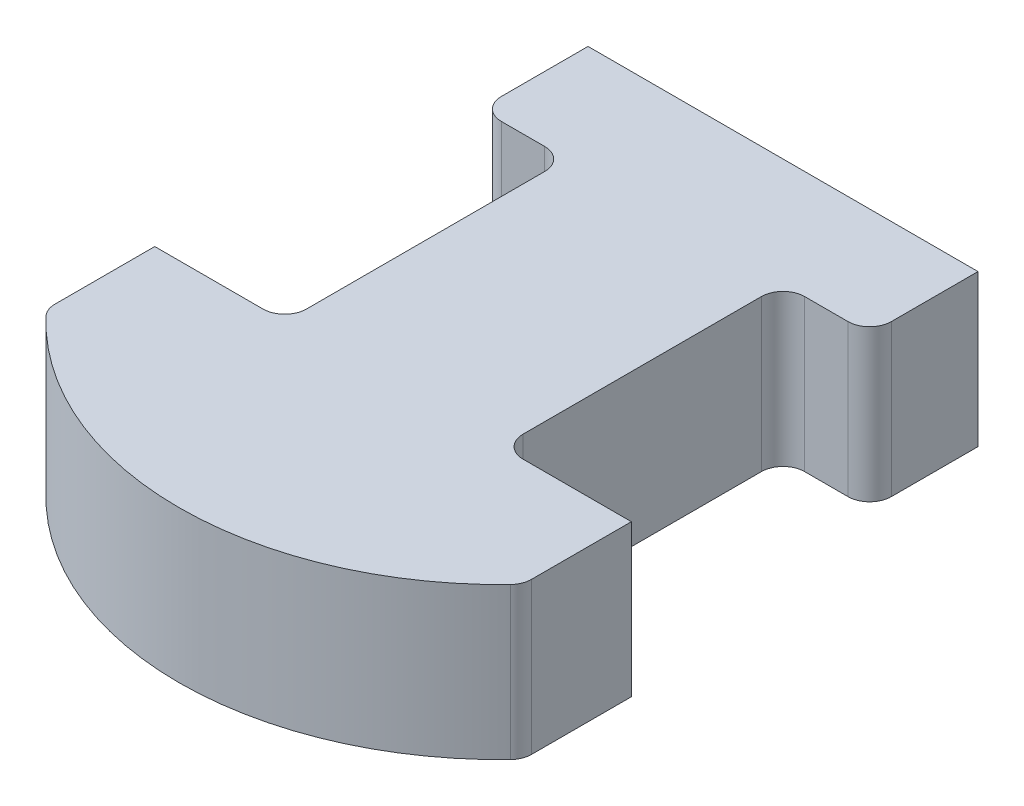
from build123d import *

# Parameters (mm, degrees)
BOSS_EXTRUDE1_DEPTH = 70
FILLET3_R           = 10
BOSS_EXTRUDE2_DEPTH = 10
FILLET4_R           = 10


with BuildPart() as part:
    # Sketch1 → Boss-Extrude1 (new body)
    with BuildSketch(Plane(origin=(0, 0, 0), x_dir=(1, 0, 0), z_dir=(0, 1, 0))):
        with BuildLine():
            Line((-90, 17.965988739), (90, 17.965988739))
            Line((90, 17.965988739), (90, -32.034011261))
            Line((90, -32.034011261), (50, -32.034011261))
            Line((50, -32.034011261), (50, -162.034011261))
            Line((50, -162.034011261), (110, -162.034011261))
            Line((110, -162.034011261), (110, -212.034011261))
            ThreePointArc((110, -212.034011261), (0, -260.808853853), (-110, -212.034011261))
            Line((-110, -212.034011261), (-110, -162.034011261))
            Line((-110, -162.034011261), (-50, -162.034011261))
            Line((-50, -162.034011261), (-50, -32.034011261))
            Line((-50, -32.034011261), (-90, -32.034011261))
            Line((-90, -32.034011261), (-90, 17.965988739))
        make_face()
        with BuildLine():
            Line((-80, 14.965988739), (80, 14.965988739))
            Line((80, 14.965988739), (80, -29.034011261))
            Line((80, -29.034011261), (45, -29.034011261))
            Line((45, -29.034011261), (45, -167.034011261))
            Line((45, -167.034011261), (95, -167.034011261))
            Line((95, -167.034011261), (95, -211.241666668))
            Line((95, -211.241666668), (58.77564579, -211.241666668))
            ThreePointArc((58.77564579, -211.241666668), (-10.047427033, -232.545270894), (-78.870499857, -211.241666668))
            Line((-78.870499857, -211.241666668), (-95, -211.241666668))
            Line((-95, -211.241666668), (-95, -167.034011261))
            Line((-95, -167.034011261), (-45, -167.034011261))
            Line((-45, -167.034011261), (-45, -29.034011261))
            Line((-45, -29.034011261), (-80, -29.034011261))
            Line((-80, -29.034011261), (-80, 14.965988739))
        make_face(mode=Mode.SUBTRACT)
    extrude(amount=BOSS_EXTRUDE1_DEPTH)

    # Fillet3
    fillet3_edges = [part.edges().sort_by_distance(p)[0] for p in [
        (-90, 35, 32.034011261),
    ]]
    fillet(fillet3_edges, radius=FILLET3_R)

    # Sketch9 → Boss-Extrude2 (add)
    with BuildSketch(Plane(origin=(0, 70, 0), x_dir=(1, 0, 0), z_dir=(0, 1, 0))):
        with BuildLine():
            Line((-90, 17.965988739), (-90, -22.034011261))
            ThreePointArc((-90, -22.034011261), (-87.071067812, -29.105079073), (-80, -32.034011261))
            Line((-80, -32.034011261), (-50, -32.034011261))
            Line((-50, -32.034011261), (-50, -162.034011261))
            Line((-50, -162.034011261), (-110, -162.034011261))
            Line((-110, -162.034011261), (-110, -212.034011261))
            ThreePointArc((-110, -212.034011261), (0, -260.808853853), (110, -212.034011261))
            Line((110, -212.034011261), (110, -162.034011261))
            Line((110, -162.034011261), (50, -162.034011261))
            Line((50, -162.034011261), (50, -32.034011261))
            Line((50, -32.034011261), (90, -32.034011261))
            Line((90, -32.034011261), (90, 17.965988739))
            Line((90, 17.965988739), (-90, 17.965988739))
        make_face()
    extrude(amount=-BOSS_EXTRUDE2_DEPTH)

    # Fillet4
    fillet4_edges = [part.edges().sort_by_distance(p)[0] for p in [
        (-45, 30, 167.034011261),
        (-45, 30, 29.034011261),
        (-80, 30, 29.034011261),
        (90, 35, 32.034011261),
        (50, 35, 32.034011261),
        (50, 35, 162.034011261),
        (110, 35, 212.034011261),
        (-110, 35, 212.034011261),
        (-50, 35, 162.034011261),
        (-50, 35, 32.034011261),
        (80, 30, 29.034011261),
        (45, 30, 29.034011261),
        (45, 30, 167.034011261),
    ]]
    fillet(fillet4_edges, radius=FILLET4_R)


solid = part.part
